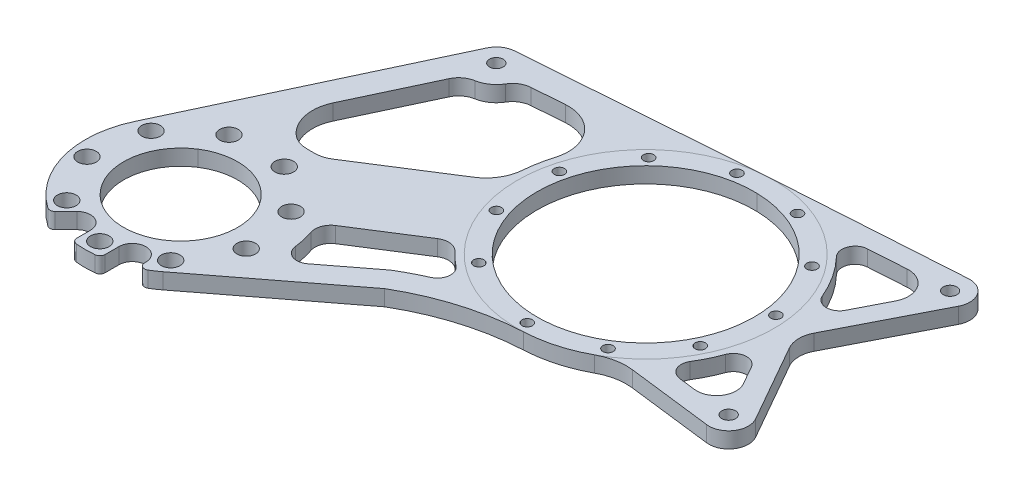
from build123d import *

# Parameters (mm, degrees)
SKETCH1_R                      = 27.4955
SKETCH1_R_2                    = 52.3875
SKETCH1_R_3                    = 3.3
BOSS_EXTRUDE1_DEPTH            = 3.81
M8_CLEARANCE_HOLE1_D           = 9
M8_CLEARANCE_HOLE1_CSINK_D     = 9.05
M8_CLEARANCE_HOLE1_CSINK_ANGLE = 90
CIRPATTERN1_COUNT              = 9
CUT_EXTRUDE2_DEPTH             = 705.3211269
CIRPATTERN3_COUNT              = 11
CIRPATTERN3_ANGLE              = 320


with BuildPart() as part:
    # Sketch1 → Boss-Extrude1 (new, symmetric)
    with BuildSketch(Plane(origin=(0, 0, 0), x_dir=(-1, 0, 0), z_dir=(0, 1, 0))):
        with BuildLine():
            Line((-663.344331246, 5.11591187), (-571.334153098, 11.036768117))
            ThreePointArc((-571.334153098, 11.036768117), (-571.018141837, 11.05791522), (-570.70224289, 11.080678619))
            Line((-570.70224289, 11.080678619), (-458.651128563, 19.443128234))
            ThreePointArc((-458.651128563, 19.443128234), (-453.955105952, 21.098716352), (-450.736142738, 24.897647282))
            Line((-450.736142738, 24.897647282), (-396.525446728, 140.500644454))
            ThreePointArc((-396.525446728, 140.500644454), (-393.715871596, 171.819021526), (-411.692336104, 197.617881552))
            ThreePointArc((-411.692336104, 197.617881552), (-413.372500119, 198.071242365), (-414.950136715, 197.336701751))
            Line((-414.950136715, 197.336701751), (-420.215020333, 192.071818133))
            ThreePointArc((-420.215020333, 192.071818133), (-427.298656721, 190.662795249), (-431.31121441, 196.668012211))
            Line((-431.31121441, 196.668012211), (-431.31121441, 203.240745001))
            ThreePointArc((-431.31121441, 203.240745001), (-431.968379704, 204.945600851), (-433.59982344, 205.768273949))
            ThreePointArc((-433.59982344, 205.768273949), (-438.15, 205.994), (-442.70017656, 205.768273949))
            ThreePointArc((-442.70017656, 205.768273949), (-444.331620296, 204.945600851), (-444.98878559, 203.240745001))
            Line((-444.98878559, 203.240745001), (-444.98878559, 196.668012211))
            ThreePointArc((-444.98878559, 196.668012211), (-451.48878559, 190.168012211), (-457.98878559, 196.668012211))
            Line((-457.98878559, 196.668012211), (-457.98878559, 197.245022653))
            ThreePointArc((-457.98878559, 197.245022653), (-459.278285753, 199.455870942), (-461.837486501, 199.421924563))
            ThreePointArc((-461.837486501, 199.421924563), (-464.019895008, 198.024699819), (-466.120112298, 196.506730383))
            Line((-466.120112298, 196.506730383), (-526.629683433, 150.121113421))
            ThreePointArc((-526.629683433, 150.121113421), (-551.530592574, 139.247052869), (-578.312485484, 134.661130809))
            ThreePointArc((-578.312485484, 134.661130809), (-592.081443241, 132.419097692), (-604.99890828, 127.151270133))
            ThreePointArc((-604.99890828, 127.151270133), (-612.407574664, 124.492595217), (-620.274454537, 124.229743629))
            Line((-620.274454537, 124.229743629), (-661.161974504, 129.250099814))
            ThreePointArc((-661.161974504, 129.250099814), (-670.249252048, 125.077827159), (-670.600960367, 115.084690838))
            Line((-670.600960367, 115.084690838), (-649.054093444, 77.225755025))
            ThreePointArc((-649.054093444, 77.225755025), (-647.394780527, 71.225067939), (-648.786811147, 65.156804956))
            Line((-648.786811147, 65.156804956), (-672.43464209, 18.961557425))
            ThreePointArc((-672.43464209, 18.961557425), (-671.918273078, 9.393648822), (-663.344331246, 5.11591187))
        make_face()
        with Locations((-438.15, 160.02)):
            Circle(SKETCH1_R, mode=Mode.SUBTRACT)
        with Locations((-575.31, 72.821477372)):
            Circle(SKETCH1_R_2, mode=Mode.SUBTRACT)
        with Locations((-662.32278, 119.79609772)):
            Circle(SKETCH1_R_3, mode=Mode.SUBTRACT)
        with Locations((-663.956, 14.621251755)):
            Circle(SKETCH1_R_3, mode=Mode.SUBTRACT)
        with Locations((-459.360014272, 28.941712658)):
            Circle(SKETCH1_R_3, mode=Mode.SUBTRACT)
    extrude(amount=BOSS_EXTRUDE1_DEPTH, both=True)

    # M8 Clearance Hole1 (through all)
    with Locations(Plane(origin=(0, -3.81, 0), x_dir=(-1, 0, 0), z_dir=(0, -1, 0))):
        with Locations((-438.15, -199.019999978)):
            m8_clearance_hole1 = CounterSinkHole(M8_CLEARANCE_HOLE1_D / 2, M8_CLEARANCE_HOLE1_CSINK_D / 2, counter_sink_angle=M8_CLEARANCE_HOLE1_CSINK_ANGLE)

    # CirPattern1: M8 Clearance Hole1 ×9 about axis
    cirpattern1_axis = Axis((438.15, 3.81, 160.02), (0, -1, 0))
    for i in range(1, CIRPATTERN1_COUNT):
        add(m8_clearance_hole1.rotate(cirpattern1_axis, i * 360 / CIRPATTERN1_COUNT), mode=Mode.SUBTRACT)

    # Sketch10 → Cut-Extrude2 (cut, through all)
    with BuildSketch(Plane.XZ.offset(3.81)):
        with BuildLine():
            Line((501.653528527, 82.025066826), (460.055399035, 108.47079033))
            ThreePointArc((460.055399035, 108.47079033), (456.789884205, 109.947588368), (453.24181467, 110.453278114))
            Line((453.24181467, 110.453278114), (449.557948705, 110.453278114))
            ThreePointArc((449.557948705, 110.453278114), (444.966962938, 109.594428804), (440.996916533, 107.134041843))
            ThreePointArc((440.996916533, 107.134041843), (435.154253671, 96.778102142), (436.590721722, 84.974765498))
            Line((436.590721722, 84.974765498), (454.490842485, 46.803191211))
            ThreePointArc((454.490842485, 46.803191211), (457.342507431, 43.270498962), (461.505556985, 41.459166331))
            ThreePointArc((461.505556985, 41.459166331), (466.5665587, 39.399041065), (470.293491627, 35.40306491))
            ThreePointArc((470.293491627, 35.40306491), (473.468249432, 32.15763422), (477.784713934, 30.750494677))
            Line((477.784713934, 30.750494677), (493.298252827, 29.592708892))
            ThreePointArc((493.298252827, 29.592708892), (509.569281047, 36.661622947), (512.959284307, 54.07494495))
            ThreePointArc((512.959284307, 54.07494495), (511.336032734, 60.722893264), (510.419523322, 67.504498748))
            ThreePointArc((510.419523322, 67.504498748), (507.74174649, 75.794215969), (501.653528527, 82.025066826))
        make_face()
        with BuildLine():
            ThreePointArc((518.5458141, 116.433517192), (523.526027217, 115.31070897), (528.083819046, 117.610655627))
            ThreePointArc((528.083819046, 117.610655627), (531.194244853, 120.677331811), (534.503353276, 123.528481221))
            ThreePointArc((534.503353276, 123.528481221), (536.820485804, 129.284400418), (533.124064721, 134.267991506))
            ThreePointArc((533.124064721, 134.267991506), (526.661398117, 137.399578344), (520.391516426, 140.901217866))
            Line((520.391516426, 140.901217866), (497.676544793, 158.314132116))
            ThreePointArc((497.676544793, 158.314132116), (491.351665893, 159.127989595), (487.50938857, 154.038455032))
            ThreePointArc((487.50938857, 154.038455032), (486.663269024, 149.130057447), (485.330309415, 144.330942547))
            ThreePointArc((485.330309415, 144.330942547), (485.381225421, 139.4135911), (488.447021855, 135.568616467))
            Line((488.447021855, 135.568616467), (518.5458141, 116.433517192))
        make_face()
        with BuildLine():
            ThreePointArc((622.282896399, 27.766736666), (620.947612088, 21.069043166), (626.45783883, 17.03425895))
            Line((626.45783883, 17.03425895), (644.438689484, 15.877190959))
            ThreePointArc((644.438689484, 15.877190959), (654.441621622, 20.86788407), (655.044052135, 32.030444107))
            Line((655.044052135, 32.030444107), (646.833678916, 48.069133834))
            ThreePointArc((646.833678916, 48.069133834), (640.940766472, 51.521041328), (635.326028557, 47.633008334))
            ThreePointArc((635.326028557, 47.633008334), (629.718866036, 37.099523997), (622.282896399, 27.766736666))
        make_face()
        with BuildLine():
            Line((643.506881083, 117.485795833), (635.420385908, 116.492899074))
            ThreePointArc((635.420385908, 116.492899074), (630.473854175, 112.946950119), (630.78232235, 106.868564021))
            ThreePointArc((630.78232235, 106.868564021), (633.867295103, 101.236717058), (636.38230144, 95.328290853))
            ThreePointArc((636.38230144, 95.328290853), (641.819407992, 91.195500663), (647.859361663, 94.383139612))
            Line((647.859361663, 94.383139612), (652.945866946, 103.320386857))
            ThreePointArc((652.945866946, 103.320386857), (652.594158627, 113.313523178), (643.506881083, 117.485795833))
        make_face()
    extrude(amount=-CUT_EXTRUDE2_DEPTH, mode=Mode.SUBTRACT)

    # Sketch14 → Ø5.0mm Dowel Hole2 (revolve, cut)
    with BuildSketch(Plane(origin=(575.31, 3.81, 129.971477372), x_dir=(0, 0, 1), z_dir=(1, 0, 0))):
        Polygon((0, 0), (0, 9.122151548), (2.5, 7.62), (2.5, 0), align=None)
    f_5_0mm_dowel_hole2 = revolve(axis=Axis((575.31, 10.16, 129.971477372), (0, -1, 0)), mode=Mode.SUBTRACT)

    # CirPattern3: Ø5.0mm Dowel Hole2 ×11 about axis
    cirpattern3_axis = Axis((575.31, 3.81, 72.821477372), (0, 1, 0))
    for i in range(1, CIRPATTERN3_COUNT):
        add(f_5_0mm_dowel_hole2.rotate(cirpattern3_axis, i * CIRPATTERN3_ANGLE / (CIRPATTERN3_COUNT - 1)), mode=Mode.SUBTRACT)


solid = part.part
